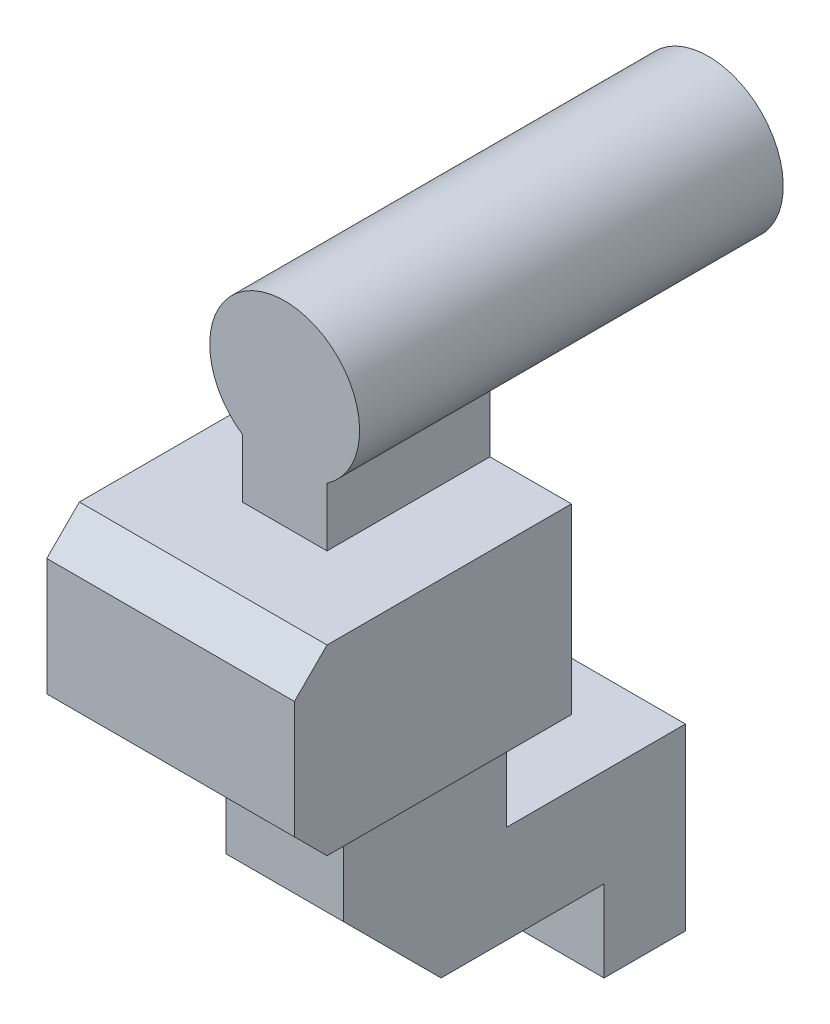
from build123d import *

# Parameters (mm, degrees)
SZKIC1_W                    = 7.6
SZKIC1_H                    = 5.6
DODANIE_WYCI_GNI_CIE1_DEPTH = 5
SZKIC2_R                    = 2.3
SZKIC2_W                    = 2.6
SZKIC2_H                    = 1.8
DODANIE_WYCI_GNI_CIE2_DEPTH = 5
SZKIC3_W                    = 3.6
SZKIC3_H                    = 7
DODANIE_WYCI_GNI_CIE3_DEPTH = 5
SZKIC4_R                    = 2.3
DODANIE_WYCI_GNI_CIE4_DEPTH = 8
SFAZOWANIE1_SIZE            = 3
SZKIC5_W                    = 3.5
SZKIC5_H                    = 5.6
DODANIE_WYCI_GNI_CIE5_DEPTH = 7.6
DODANIE_WYCI_GNI_CIE6_DEPTH = 3.6
SFAZOWANIE3_SIZE            = 1


with BuildPart() as part:
    # Szkic1 → Dodanie-wyciągnięcie1 (new body)
    with BuildSketch(Plane.XY):
        Rectangle(SZKIC1_W, SZKIC1_H)
    extrude(amount=DODANIE_WYCI_GNI_CIE1_DEPTH)

    # Szkic2 → Dodanie-wyciągnięcie2 (add)
    with BuildSketch(Plane.XY.offset(5)):
        with Locations((0, 6.497366596)):
            Circle(SZKIC2_R)
        with Locations((0, 3.7)):
            Rectangle(SZKIC2_W, SZKIC2_H)
    extrude(amount=-DODANIE_WYCI_GNI_CIE2_DEPTH)

    # Szkic3 → Dodanie-wyciągnięcie3 (add)
    with BuildSketch(Plane.XY.offset(5)):
        with Locations((0, -6.3)):
            Rectangle(SZKIC3_W, SZKIC3_H)
    extrude(amount=-DODANIE_WYCI_GNI_CIE3_DEPTH)

    # Szkic4 → Dodanie-wyciągnięcie4 (add)
    with BuildSketch(Plane(origin=(0, 0, 0), x_dir=(-1, 0, 0), z_dir=(0, 0, -1))):
        with Locations(Location((0, 6.497366596, 0), (0, 0, 235.58261129))):
            Circle(SZKIC4_R)
    extrude(amount=DODANIE_WYCI_GNI_CIE4_DEPTH)

    # Sfazowanie1
    sfazowanie1_edges = [part.edges().sort_by_distance(p)[0] for p in [
        (0, -9.8, 5),
    ]]
    chamfer(sfazowanie1_edges, length=SFAZOWANIE1_SIZE)

    # Szkic5 → Dodanie-wyciągnięcie5 (add)
    with BuildSketch(Plane(origin=(3.8, 0, 0), x_dir=(0, 0, -1), z_dir=(1, 0, 0))):
        with Locations((-6.75, 0)):
            Rectangle(SZKIC5_W, SZKIC5_H)
    extrude(amount=-DODANIE_WYCI_GNI_CIE5_DEPTH)

    # Szkic6 → Dodanie-wyciągnięcie6 (add)
    with BuildSketch(Plane.ZY.offset(1.8)):
        Polygon((0, -9.8), (-3, -9.8), (-3, -12.3), (-5.5, -12.3), (-5.5, -6.8), (0, -6.8), align=None)
    extrude(amount=-DODANIE_WYCI_GNI_CIE6_DEPTH)

    # Sfazowanie3
    sfazowanie3_edges = [part.edges().sort_by_distance(p)[0] for p in [
        (0, -2.8, 8.5),
        (0, 2.8, 8.5),
    ]]
    chamfer(sfazowanie3_edges, length=SFAZOWANIE3_SIZE)


solid = part.part
